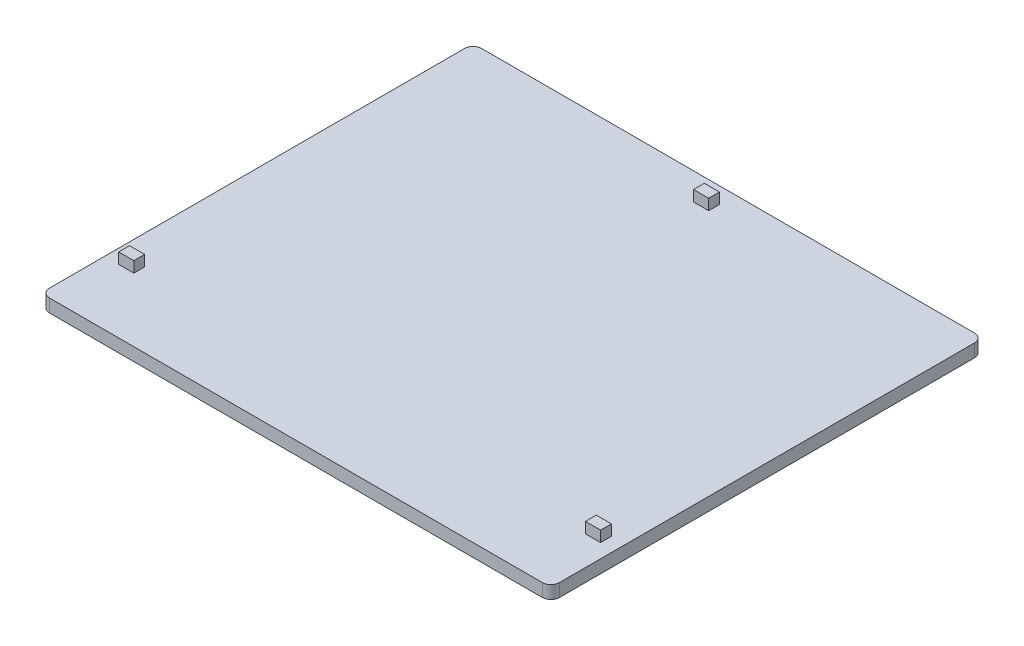
from build123d import *

# Parameters (mm, degrees)
SKETCH1_W           = 118
SKETCH1_H           = 100
BOSS_EXTRUDE1_DEPTH = 3
FILLET1_R           = 2
SKETCH2_W           = 3.5
SKETCH2_H           = 2.5
BOSS_EXTRUDE2_DEPTH = 2.5


with BuildPart() as part:
    # Sketch1 → Boss-Extrude1 (new body)
    with BuildSketch(Plane(origin=(0, 0, 0), x_dir=(1, 0, 0), z_dir=(0, 1, 0))):
        Rectangle(SKETCH1_W, SKETCH1_H)
    extrude(amount=BOSS_EXTRUDE1_DEPTH)

    # Fillet1
    fillet1_edges = [part.edges().sort_by_distance(p)[0] for p in [
        (59, 1.5, 50),
        (-59, 1.5, 50),
        (-59, 1.5, -50),
        (59, 1.5, -50),
    ]]
    fillet(fillet1_edges, radius=FILLET1_R)

    # Sketch2 → Boss-Extrude2 (add)
    with BuildSketch(Plane(origin=(0, 3, 0), x_dir=(1, 0, 0), z_dir=(0, 1, 0))):
        with Locations((-54, -34)):
            Rectangle(SKETCH2_W, SKETCH2_H)
        with Locations((54, -34)):
            Rectangle(SKETCH2_W, SKETCH2_H)
        with Locations((0, 45)):
            Rectangle(SKETCH2_W, SKETCH2_H)
    extrude(amount=BOSS_EXTRUDE2_DEPTH)


solid = part.part
